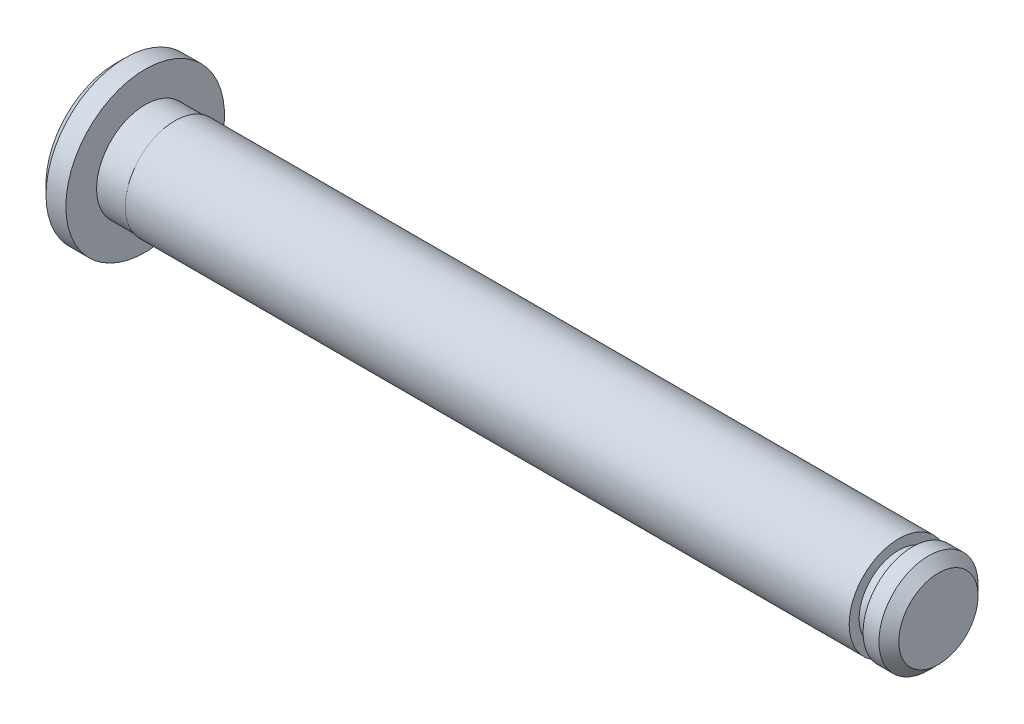
from build123d import *

# Parameters (mm, degrees)
CHAMFER1_SIZE = 0.5


with BuildPart() as part:
    # Sketch1 → Revolve1 (revolve)
    with BuildSketch(Plane.XY, mode=Mode.PRIVATE) as revolve1_sk:
        Polygon((-1.5, 0), (-1.5, 4), (0, 4), (0, 2.45), (1.5, 2.45), (1.5, 2.5), (38, 2.5), (38, 2), (38.7, 2), (38.7, 2.5), (40, 2.5), (40, 0), align=None)
    revolve(revolve1_sk.sketch.rotate(Axis((0, 0, 0), (1, 0, 0)), 90), axis=Axis((0, 0, 0), (1, 0, 0)))

    # Chamfer1
    chamfer1_edges = [part.edges().sort_by_distance(p)[0] for p in [
        (-1.5, 0, -4),
        (40, 0, -2.5),
    ]]
    chamfer(chamfer1_edges, length=CHAMFER1_SIZE)


solid = part.part
